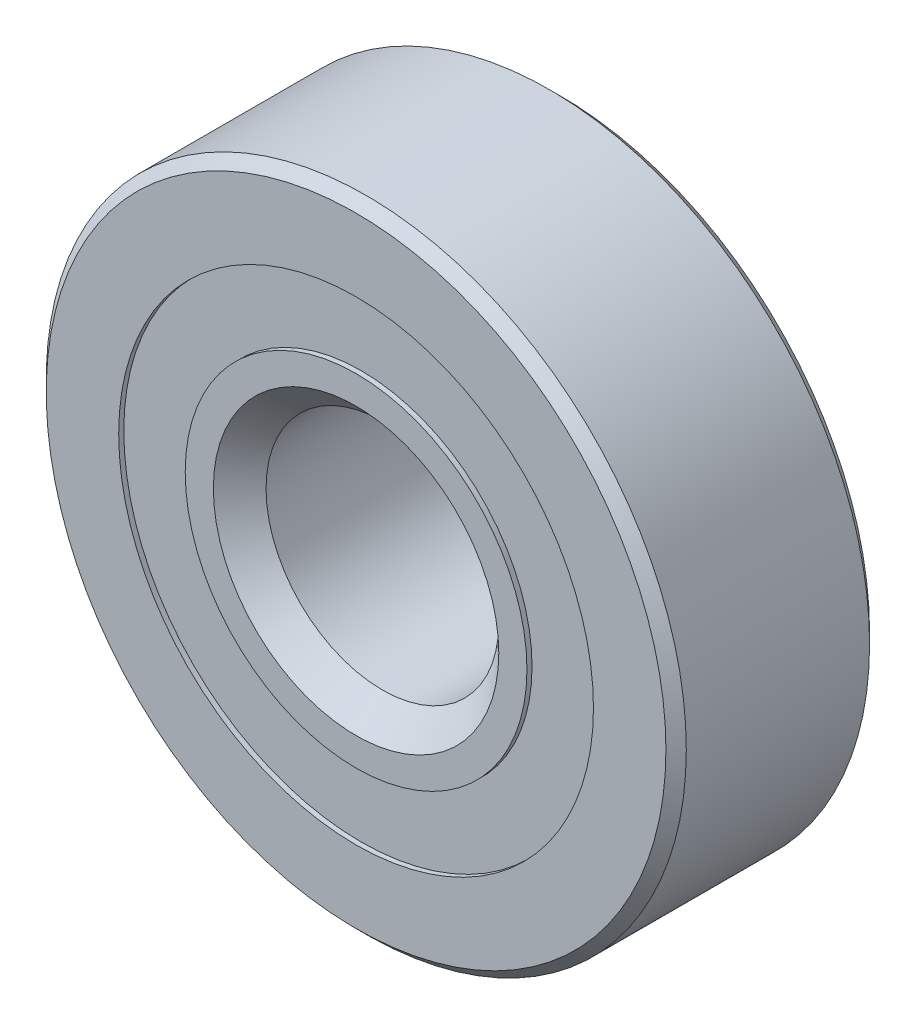
from build123d import *

# Parameters (mm, degrees)
CIRPATTERN1_COUNT = 12
SKETCH5_W         = 2.596321981
SKETCH5_H         = 3.629646325


with BuildPart() as part:
    # Sketch1 → Revolve1 (revolve)
    with BuildSketch(Plane(origin=(0, 0, 0), x_dir=(0, 0, -1), z_dir=(1, 0, 0))):
        with BuildLine():
            Line((5.000625, 17.4625), (-5.000625, 17.4625))
            Line((-5.000625, 17.4625), (-5.55625, 16.906875))
            Line((-5.55625, 16.906875), (-5.55625, 12.952953297))
            Line((-5.55625, 12.952953297), (-2.469444444, 12.952953297))
            ThreePointArc((-2.469444444, 12.952953297), (0, 14.588365519), (2.469444444, 12.952953297))
            Line((2.469444444, 12.952953297), (5.55625, 12.952953297))
            Line((5.55625, 12.952953297), (5.55625, 16.906875))
            Line((5.55625, 16.906875), (5.000625, 17.4625))
        make_face()
    revolve(axis=Axis((0, 0, 5.55625), (0, 0, -1)))


with BuildPart() as body_2:
    # Sketch3 → Revolve3 (revolve)
    with BuildSketch(Plane(origin=(0, 0, 0), x_dir=(0, 0, -1), z_dir=(1, 0, 0))):
        with BuildLine():
            Line((-5.2784375, 9.045494472), (-4.020010269, 7.787067241))
            Line((-4.020010269, 7.787067241), (0, 7.787067241))
            Line((0, 7.787067241), (0, 9.224134481))
            ThreePointArc((0, 9.224134481), (1.480939651, 9.670056492), (2.469444444, 10.859546703))
            Line((2.469444444, 10.859546703), (5.55625, 10.859546703))
            Line((5.55625, 10.859546703), (5.55625, 6.905625))
            Line((5.55625, 6.905625), (5.000625, 6.35))
            Line((5.000625, 6.35), (-4.119182759, 6.35))
            Line((-4.119182759, 6.35), (-5.55625, 7.787067241))
            Line((-5.55625, 7.787067241), (-5.55625, 9.323306972))
            Line((-5.55625, 9.323306972), (-5.2784375, 9.323306972))
            Line((-5.2784375, 9.323306972), (-5.2784375, 9.045494472))
        make_face()
    revolve(axis=Axis((0, 0, 5.55625), (0, 0, -1)))


with BuildPart() as body_3:
    # Sketch4 → Revolve4 (revolve)
    with BuildSketch(Plane(origin=(0, 0, 0), x_dir=(0, 0, -1), z_dir=(1, 0, 0))):
        with BuildLine():
            Line((-2.682115519, 11.90625), (2.682115519, 11.90625))
            ThreePointArc((2.682115519, 11.90625), (0, 14.588365519), (-2.682115519, 11.90625))
        make_face()
    revolve(axis=Axis((0, 11.90625, 2.682115519), (0, 0, -1)))


with BuildPart() as cirpattern1_1:
    # CirPattern1: pattern copy
    add(body_3.part.rotate(Axis((0, 0, -5.55625), (0, 0, 1)), 1 * 360 / CIRPATTERN1_COUNT))


with BuildPart() as cirpattern1_2:
    # CirPattern1: pattern copy
    add(body_3.part.rotate(Axis((0, 0, -5.55625), (0, 0, 1)), 2 * 360 / CIRPATTERN1_COUNT))


with BuildPart() as cirpattern1_3:
    # CirPattern1: pattern copy
    add(body_3.part.rotate(Axis((0, 0, -5.55625), (0, 0, 1)), 3 * 360 / CIRPATTERN1_COUNT))


with BuildPart() as cirpattern1_4:
    # CirPattern1: pattern copy
    add(body_3.part.rotate(Axis((0, 0, -5.55625), (0, 0, 1)), 4 * 360 / CIRPATTERN1_COUNT))


with BuildPart() as cirpattern1_5:
    # CirPattern1: pattern copy
    add(body_3.part.rotate(Axis((0, 0, -5.55625), (0, 0, 1)), 5 * 360 / CIRPATTERN1_COUNT))


with BuildPart() as cirpattern1_6:
    # CirPattern1: pattern copy
    add(body_3.part.rotate(Axis((0, 0, -5.55625), (0, 0, 1)), 6 * 360 / CIRPATTERN1_COUNT))


with BuildPart() as cirpattern1_7:
    # CirPattern1: pattern copy
    add(body_3.part.rotate(Axis((0, 0, -5.55625), (0, 0, 1)), 7 * 360 / CIRPATTERN1_COUNT))


with BuildPart() as cirpattern1_8:
    # CirPattern1: pattern copy
    add(body_3.part.rotate(Axis((0, 0, -5.55625), (0, 0, 1)), 8 * 360 / CIRPATTERN1_COUNT))


with BuildPart() as cirpattern1_9:
    # CirPattern1: pattern copy
    add(body_3.part.rotate(Axis((0, 0, -5.55625), (0, 0, 1)), 9 * 360 / CIRPATTERN1_COUNT))


with BuildPart() as cirpattern1_10:
    # CirPattern1: pattern copy
    add(body_3.part.rotate(Axis((0, 0, -5.55625), (0, 0, 1)), 10 * 360 / CIRPATTERN1_COUNT))


with BuildPart() as cirpattern1_11:
    # CirPattern1: pattern copy
    add(body_3.part.rotate(Axis((0, 0, -5.55625), (0, 0, 1)), 11 * 360 / CIRPATTERN1_COUNT))


with BuildPart() as body_15:
    # Sketch5 → Revolve5 (revolve)
    with BuildSketch(Plane(origin=(0, 0, 0), x_dir=(0, 0, -1), z_dir=(1, 0, 0))):
        with Locations((-3.98027651, 11.138130135)):
            Rectangle(SKETCH5_W, SKETCH5_H)
        with Locations((3.98027651, 11.138130135)):
            Rectangle(SKETCH5_W, SKETCH5_H)
    revolve(axis=Axis((0, 0, 5.55625), (0, 0, -1)))


solid = Compound([part.part, body_2.part, body_3.part, cirpattern1_1.part, cirpattern1_2.part, cirpattern1_3.part, cirpattern1_4.part, cirpattern1_5.part, cirpattern1_6.part, cirpattern1_7.part, cirpattern1_8.part, cirpattern1_9.part, cirpattern1_10.part, cirpattern1_11.part, body_15.part])
